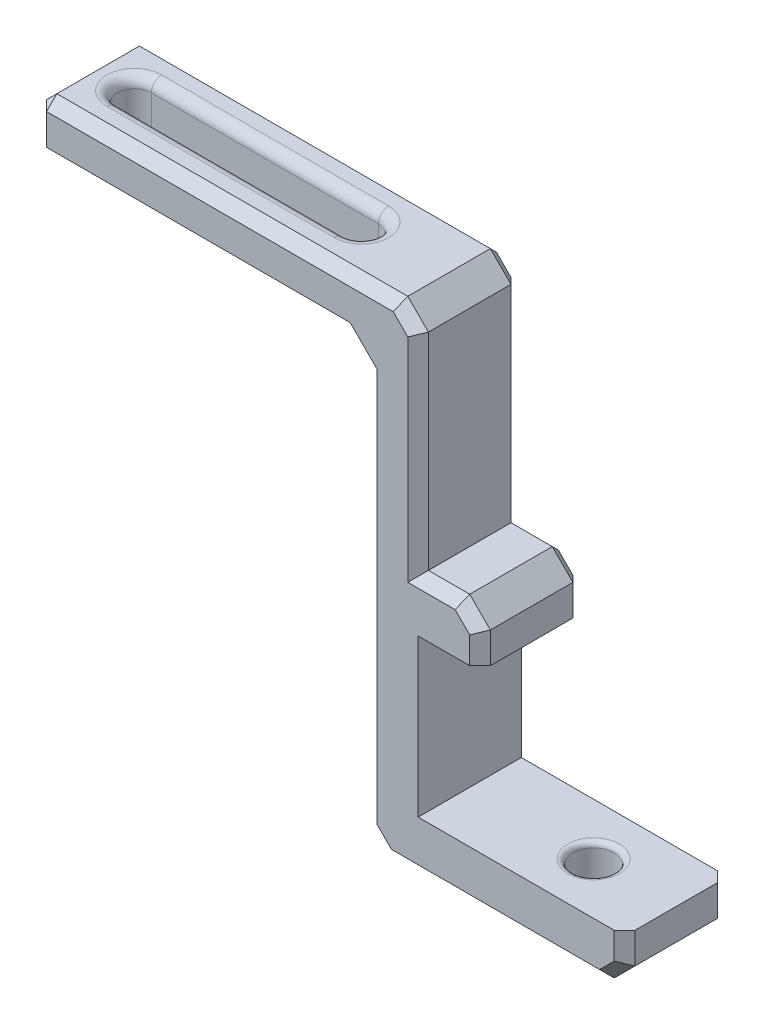
from build123d import *

# Parameters (mm, degrees)
RESSALTO_EXTRUS_O1_DEPTH = 10
ESBO_O3_R                = 2
CORTE_EXTRUS_O1_DEPTH    = 15
CHANFRO1_SIZE            = 1.6
FILETE1_R                = 0.5
CHANFRO5_SIZE            = 2
CHANFRO8_SIZE            = 1
CORTE_EXTRUS_O3_DEPTH    = 10
FILETE3_R                = 1


with BuildPart() as part:
    # Esboço1 → Ressalto-extrusão1 (new body)
    with BuildSketch(Plane.XY):
        Polygon((1.886382163, -7.75), (-4.113617837, -7.75), (-4.113617837, -22.95), (15.886382163, -22.95), (15.886382163, -27.95), (-9.113617837, -27.95), (-9.113617837, 14.25), (-41.113617837, 14.25), (-41.113617837, 19.25), (-4.113617837, 19.25), (-4.113617837, -2.75), (1.886382163, -2.75), align=None)
    extrude(amount=RESSALTO_EXTRUS_O1_DEPTH)

    # Esboço3 → Corte-extrusão1 (cut)
    with BuildSketch(Plane.XZ.offset(27.95)):
        with Locations(Location((7.886382163, 5, 0), (0, 0, 270))):
            Circle(ESBO_O3_R)
    extrude(amount=-CORTE_EXTRUS_O1_DEPTH, mode=Mode.SUBTRACT)

    # Chanfro1
    chanfro1_edges = [part.edges().sort_by_distance(p)[0] for p in [
        (7.886382163, -27.95, 7),
    ]]
    chamfer(chanfro1_edges, length=CHANFRO1_SIZE)

    # Filete1
    filete1_edges = [part.edges().sort_by_distance(p)[0] for p in [
        (7.886382163, -22.95, 7),
    ]]
    fillet(filete1_edges, radius=FILETE1_R)

    # Chanfro5
    chanfro5_edges = [part.edges().sort_by_distance(p)[0] for p in [
        (15.886382163, -27.95, 5),
        (-9.113617837, -27.95, 5),
        (-9.113617837, 14.25, 5),
        (-4.113617837, 19.25, 5),
        (1.886382163, -2.75, 5),
    ]]
    chamfer(chanfro5_edges, length=CHANFRO5_SIZE)

    # Chanfro8
    chanfro8_edges = [part.edges().sort_by_distance(p)[0] for p in [
        (-4.113617837, 7.25, 10),
        (-26.113617837, 14.25, 0),
        (-41.113617837, 16.75, 0),
        (-4.113617837, 7.25, 0),
        (1.886382163, -6.25, 0),
        (-41.113617837, 16.75, 10),
        (-41.113617837, 14.25, 5),
        (-41.113617837, 19.25, 5),
        (-26.113617837, 14.25, 10),
        (-9.113617837, -6.85, 0),
        (1.886382163, -6.25, 10),
        (-9.113617837, -6.85, 10),
        (-23.613617837, 19.25, 0),
        (-23.613617837, 19.25, 10),
        (15.886382163, -24.45, 0),
        (3.386382163, -27.95, 0),
        (-2.113617837, -2.75, 0),
        (0.886382163, -3.75, 0),
        (14.886382163, -26.95, 0),
        (-8.113617837, -26.95, 0),
        (-5.113617837, 18.25, 0),
        (-2.113617837, -2.75, 10),
        (3.386382163, -27.95, 10),
        (15.886382163, -24.45, 10),
        (0.886382163, -3.75, 10),
        (14.886382163, -26.95, 10),
        (-8.113617837, -26.95, 10),
        (-5.113617837, 18.25, 10),
        (-10.113617837, 13.25, 0),
        (-10.113617837, 13.25, 10),
    ]]
    chamfer(chanfro8_edges, length=CHANFRO8_SIZE)

    # Esboço4 → Corte-extrusão3 (cut)
    with BuildSketch(Plane.XZ.offset(-14.25)):
        with BuildLine():
            Line((-36.613617837, 6.65), (-14.613617837, 6.65))
            ThreePointArc((-14.613617837, 6.65), (-12.963617837, 5), (-14.613617837, 3.35))
            Line((-14.613617837, 3.35), (-36.613617837, 3.35))
            ThreePointArc((-36.613617837, 3.35), (-38.263617837, 5), (-36.613617837, 6.65))
        make_face()
    extrude(amount=-CORTE_EXTRUS_O3_DEPTH, mode=Mode.SUBTRACT)

    # Filete3
    filete3_edges = [part.edges().sort_by_distance(p)[0] for p in [
        (-38.263617837, 19.25, 5),
        (-25.613617837, 19.25, 6.65),
        (-12.963617837, 19.25, 5),
        (-25.613617837, 19.25, 3.35),
        (-38.263617837, 14.25, 5),
        (-25.613617837, 14.25, 3.35),
        (-12.963617837, 14.25, 5),
        (-25.613617837, 14.25, 6.65),
    ]]
    fillet(filete3_edges, radius=FILETE3_R)


solid = part.part
